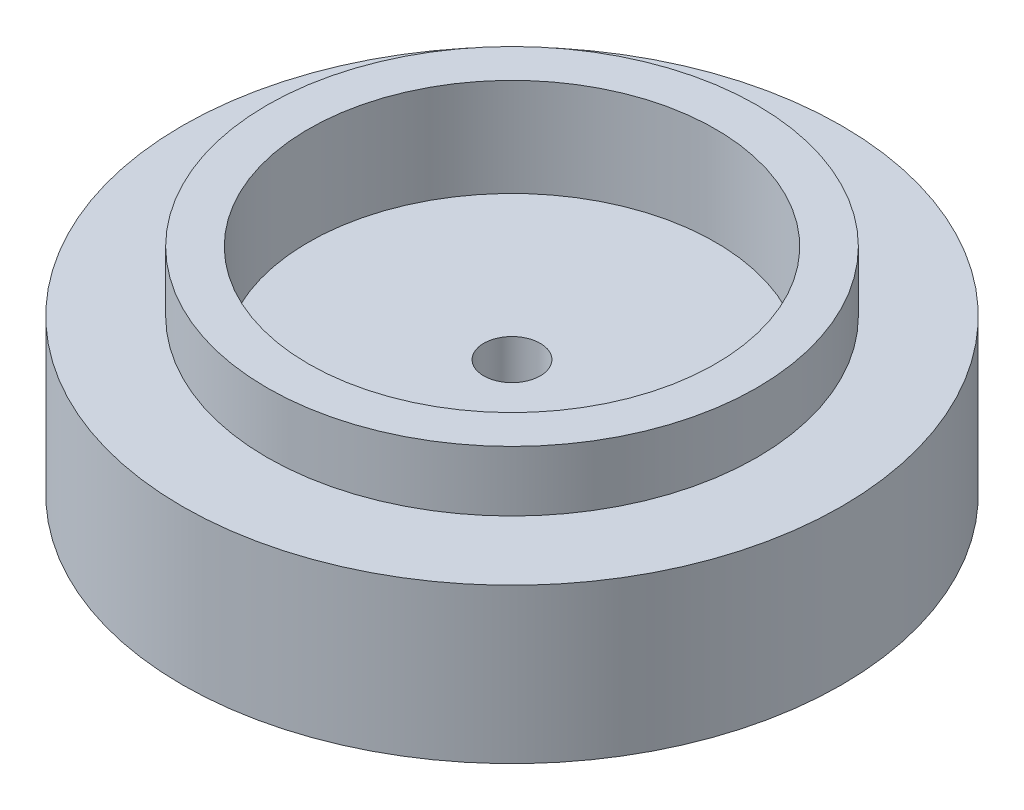
from build123d import *

# Parameters (mm, degrees)
SKETCH1_R           = 17.5
BOSS_EXTRUDE1_DEPTH = 8.2
SKETCH6_R           = 12
BOSS_EXTRUDE4_DEPTH = 2
SKETCH3_R           = 13
BOSS_EXTRUDE5_DEPTH = 3.2
SKETCH7_R           = 10.8
CUT_EXTRUDE3_DEPTH  = 4
CUT_EXTRUDE4_START  = -5.2
SKETCH8_R           = 10.8
CUT_EXTRUDE4_DEPTH  = 5.2
SKETCH9_R           = 1.5
CUT_EXTRUDE5_DEPTH  = 27.071823872


with BuildPart() as part:
    # Sketch1 → Boss-Extrude1 (new body)
    with BuildSketch(Plane(origin=(0, 0, 0), x_dir=(1, 0, 0), z_dir=(0, 1, 0))):
        with Locations(Location((0, 0, 0), (0, 0, 270))):
            Circle(SKETCH1_R)
    extrude(amount=BOSS_EXTRUDE1_DEPTH)

    # Sketch6 → Boss-Extrude4 (add)
    with BuildSketch(Plane.XZ):
        with Locations(Location((0, 0, 0), (0, 0, 90))):
            Circle(SKETCH6_R)
    extrude(amount=BOSS_EXTRUDE4_DEPTH)

    # Sketch3 → Boss-Extrude5 (add)
    with BuildSketch(Plane(origin=(0, 8.2, 0), x_dir=(1, 0, 0), z_dir=(0, 1, 0))):
        with Locations(Location((0, 0, 0), (0, 0, 270))):
            Circle(SKETCH3_R)
    extrude(amount=BOSS_EXTRUDE5_DEPTH)

    # Sketch7 → Cut-Extrude3 (cut)
    with BuildSketch(Plane.XZ.offset(2)):
        with Locations(Location((0, 0, 0), (0, 0, 270))):
            Circle(SKETCH7_R)
    extrude(amount=-CUT_EXTRUDE3_DEPTH, mode=Mode.SUBTRACT)

    # Sketch8 → Cut-Extrude4 (cut)
    with BuildSketch(Plane(origin=(0, 11.4, 0), x_dir=(1, 0, 0), z_dir=(0, 1, 0)).offset(CUT_EXTRUDE4_START)):
        with Locations(Location((0, 0, 0), (0, 0, 90))):
            Circle(SKETCH8_R)
    extrude(amount=CUT_EXTRUDE4_DEPTH, mode=Mode.SUBTRACT)

    # Sketch9 → Cut-Extrude5 (cut, through all)
    with BuildSketch(Plane(origin=(0, 6.2, 0), x_dir=(1, 0, 0), z_dir=(0, 1, 0))):
        with Locations(Location((0, 0, 0), (0, 0, 270))):
            Circle(SKETCH9_R)
    extrude(amount=-CUT_EXTRUDE5_DEPTH, mode=Mode.SUBTRACT)


solid = part.part
